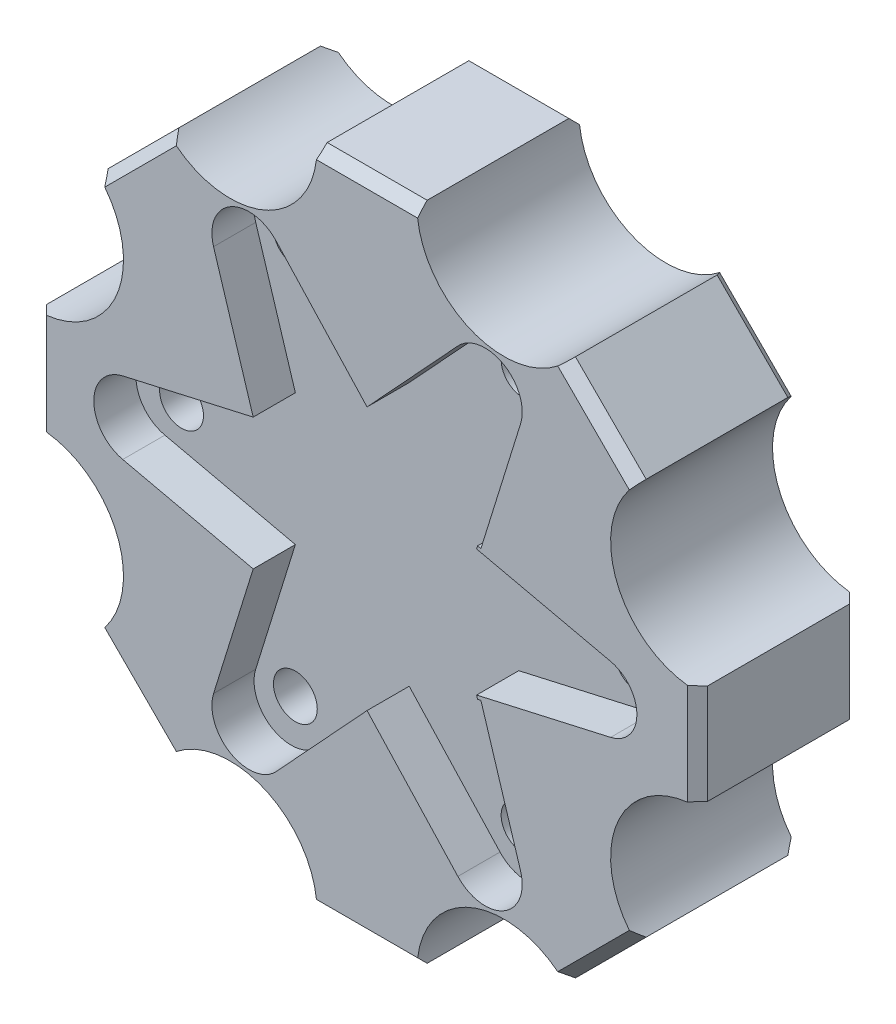
from build123d import *

# Parameters (mm, degrees)
BOSS_EXTRUDE1_DEPTH  = 9.6
CHAMFER2_SIZE        = 0.6
CUT_EXTRUDE2_DEPTH   = 2.5
M2_CLEARANCE_HOLE1_D = 2.6
CUT_EXTRUDE3_START   = -9.6
CUT_EXTRUDE3_DEPTH   = 5.5


with BuildPart() as part:
    # Sketch1 → Boss-Extrude1 (new body)
    with BuildSketch(Plane.XY):
        with BuildLine():
            ThreePointArc((-11.756599923, -15.949743136), (-6.144180323, -14.833363466), (-2.965, -19.591343059))
            Line((-2.965, -19.591343059), (2.965, -19.591343059))
            ThreePointArc((2.965, -19.591343059), (6.144180323, -14.833363466), (11.756599923, -15.949743136))
            Line((11.756599923, -15.949743136), (15.949743136, -11.756599923))
            ThreePointArc((15.949743136, -11.756599923), (14.833363466, -6.144180323), (19.591343059, -2.965))
            Line((19.591343059, -2.965), (19.591343059, 2.965))
            ThreePointArc((19.591343059, 2.965), (14.833363466, 6.144180323), (15.949743136, 11.756599923))
            Line((15.949743136, 11.756599923), (11.756599923, 15.949743136))
            ThreePointArc((11.756599923, 15.949743136), (6.144180323, 14.833363466), (2.965, 19.591343059))
            Line((2.965, 19.591343059), (-2.965, 19.591343059))
            ThreePointArc((-2.965, 19.591343059), (-6.144180323, 14.833363466), (-11.756599923, 15.949743136))
            Line((-11.756599923, 15.949743136), (-15.949743136, 11.756599923))
            ThreePointArc((-15.949743136, 11.756599923), (-14.833363466, 6.144180323), (-19.591343059, 2.965))
            Line((-19.591343059, 2.965), (-19.591343059, -2.965))
            ThreePointArc((-19.591343059, -2.965), (-14.833363466, -6.144180323), (-15.949743136, -11.756599923))
            Line((-15.949743136, -11.756599923), (-11.756599923, -15.949743136))
        make_face()
    extrude(amount=BOSS_EXTRUDE1_DEPTH)

    # Chamfer2
    chamfer2_edges = [part.edges().sort_by_distance(p)[0] for p in [
        (-19.591343059, 0, 9.6),
        (-13.853171529, 13.853171529, 0),
        (0, 19.591343059, 0),
        (13.853171529, 13.853171529, 0),
        (19.591343059, 0, 0),
        (-13.853171529, -13.853171529, 9.6),
        (13.853171529, -13.853171529, 0),
        (0, -19.591343059, 0),
        (-13.853171529, -13.853171529, 0),
        (-19.591343059, 0, 0),
        (0, -19.591343059, 9.6),
        (13.853171529, -13.853171529, 9.6),
        (19.591343059, 0, 9.6),
        (13.853171529, 13.853171529, 9.6),
        (0, 19.591343059, 9.6),
        (-13.853171529, 13.853171529, 9.6),
    ]]
    chamfer(chamfer2_edges, length=CHAMFER2_SIZE)

    # Sketch4 → Cut-Extrude2 (cut)
    with BuildSketch(Plane.XY.offset(9.6)):
        with BuildLine():
            ThreePointArc((14.441692106, -1.95061736), (16, 0), (14.441692106, 1.95061736))
            Line((14.441692106, 1.95061736), (6.69085075, 3.70569527))
            Line((6.69085075, 3.70569527), (6.495190528, 3.75))
            Line((6.495190528, 3.75), (6.554651618, 3.941599088))
            Line((6.554651618, 3.941599088), (6.750311839, 3.897294358))
            Line((6.750311839, 3.897294358), (9.101143263, 11.472284348))
            ThreePointArc((9.101143263, 11.472284348), (8.1, 14.029611541), (5.384718053, 13.617963443))
            Line((5.384718053, 13.617963443), (0, 7.794588715))
            Line((0, 7.794588715), (-5.384718053, 13.617963443))
            ThreePointArc((-5.384718053, 13.617963443), (-8.1, 14.029611541), (-9.101143263, 11.472284348))
            Line((-9.101143263, 11.472284348), (-6.750311839, 3.897294358))
            Line((-6.750311839, 3.897294358), (-14.485861316, 2.145679096))
            ThreePointArc((-14.485861316, 2.145679096), (-16.2, 0), (-14.485861316, -2.145679096))
            Line((-14.485861316, -2.145679096), (-6.750311839, -3.897294358))
            Line((-6.750311839, -3.897294358), (-9.101143263, -11.472284348))
            ThreePointArc((-9.101143263, -11.472284348), (-8.1, -14.029611541), (-5.384718053, -13.617963443))
            Line((-5.384718053, -13.617963443), (0, -7.794588715))
            Line((0, -7.794588715), (5.384718053, -13.617963443))
            ThreePointArc((5.384718053, -13.617963443), (8.1, -14.029611541), (9.101143263, -11.472284348))
            Line((9.101143263, -11.472284348), (6.750311839, -3.897294358))
            Line((6.750311839, -3.897294358), (6.554651618, -3.941599088))
            Line((6.554651618, -3.941599088), (6.495190528, -3.75))
            Line((6.495190528, -3.75), (6.69085075, -3.70569527))
            Line((6.69085075, -3.70569527), (14.441692106, -1.95061736))
        make_face()
    extrude(amount=-CUT_EXTRUDE2_DEPTH, mode=Mode.SUBTRACT)

    # M2 Clearance Hole1 (through all)
    with Locations(Plane.XY.offset(7.1)):
        with Locations((13.5, 0), (6.75, -11.691342951), (-6.75, -11.691342951), (-13.5, 0), (-6.75, 11.691342951), (6.75, 11.691342951)):
            Hole(M2_CLEARANCE_HOLE1_D / 2)

    # Sketch3<2> → Cut-Extrude3 (cut)
    with BuildSketch(Plane.XY.offset(9.6).offset(CUT_EXTRUDE3_START)):
        with BuildLine():
            Line((-2, -1.5), (-5.5, -1.5))
            Line((-5.5, -1.5), (-5.5, 1.5))
            Line((-5.5, 1.5), (-2, 1.5))
            ThreePointArc((-2, 1.5), (0, 2.5), (2, 1.5))
            Line((2, 1.5), (5.5, 1.5))
            Line((5.5, 1.5), (5.5, -1.5))
            Line((5.5, -1.5), (2, -1.5))
            ThreePointArc((2, -1.5), (0, -2.5), (-2, -1.5))
        make_face()
    extrude(amount=CUT_EXTRUDE3_DEPTH, mode=Mode.SUBTRACT)


solid = part.part
